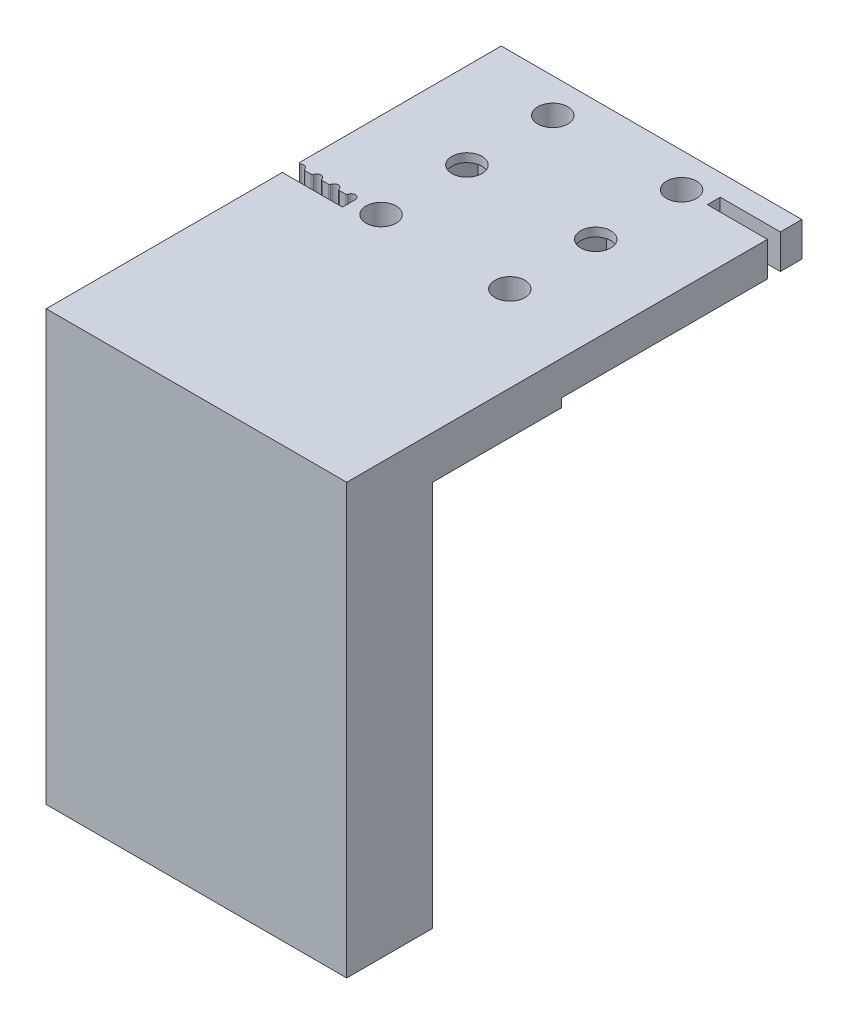
from build123d import *

# Parameters (mm, degrees)
SKETCH1_W           = 35
SKETCH1_H           = 28.000000000000004
BOSS_EXTRUDE1_DEPTH = 4
SKETCH2_R           = 1.7499999999999998
CUT_EXTRUDE1_DEPTH  = 23.765104875664424
BOSS_EXTRUDE2_DEPTH = 25
CUT_EXTRUDE14_DEPTH = 66.78183639881149
SKETCH19_R          = 1.75
CUT_EXTRUDE15_DEPTH = 66.78183639881149
CUT_EXTRUDE16_DEPTH = 2.999999999999999
SKETCH21_R          = 0.49999999999999917
CUT_EXTRUDE17_DEPTH = 3.999999999999999
LPATTERN2_COUNT     = 4
LPATTERN2_PITCH     = 2
FILLET2_R           = 0.15
SKETCH22_W          = 14.999999999999995
SKETCH22_H          = 45
CUT_EXTRUDE18_DEPTH = 70.72804313904126


with BuildPart() as part:
    # Sketch1 → Boss-Extrude1 (new body)
    with BuildSketch(Plane(origin=(0, 0, 0), x_dir=(1, 0, 0), z_dir=(0, 1, 0))):
        Rectangle(SKETCH1_W, SKETCH1_H)
    extrude(amount=BOSS_EXTRUDE1_DEPTH)

    # Sketch2 → Cut-Extrude1 (cut, through all)
    with BuildSketch(Plane(origin=(0, 4, 0), x_dir=(1, 0, 0), z_dir=(0, 1, 0))):
        with Locations(Location((-7.499999999999998, -10, 0), (0, 0, 270))):
            Circle(SKETCH2_R)
        with Locations(Location((-7.499999999999998, 10, 0), (0, 0, 270))):
            Circle(SKETCH2_R)
        with Locations(Location((7.500000000000002, -10.000000000000002, 0), (0, 0, 270))):
            Circle(SKETCH2_R)
        with Locations(Location((7.500000000000002, 10, 0), (0, 0, 270))):
            Circle(SKETCH2_R)
    extrude(amount=-CUT_EXTRUDE1_DEPTH, mode=Mode.SUBTRACT)

    # Sketch3 → Boss-Extrude2 (add)
    with BuildSketch(Plane.XY.offset(14)):
        Polygon((-17.499999999999996, 4), (17.500000000000004, 4), (17.50000000000001, -46), (-17.499999999999993, -46), align=None)
    extrude(amount=BOSS_EXTRUDE2_DEPTH)

    # Sketch18 → Cut-Extrude14 (cut, through all)
    with BuildSketch(Plane(origin=(0, 4, 0), x_dir=(1, 0, 0), z_dir=(0, 1, 0))):
        Polygon((-17.499999999999996, -9.999999999999998), (-10.499999999999998, -10.000000000000002), (-10.499999999999998, -11.500000000000002), (-17.499999999999996, -11.500000000000004), align=None)
        Polygon((17.500000000000004, 10.000000000000002), (10.500000000000002, 10), (10.500000000000002, 11.5), (17.500000000000004, 11.500000000000004), align=None)
    extrude(amount=-CUT_EXTRUDE14_DEPTH, mode=Mode.SUBTRACT)

    # Sketch19 → Cut-Extrude15 (cut, through all)
    with BuildSketch(Plane(origin=(0, 4, 0), x_dir=(1, 0, 0), z_dir=(0, 1, 0))):
        with Locations(Location((-7.499999999999998, 0, 0), (0, 0, 270))):
            Circle(SKETCH19_R)
        with Locations(Location((7.500000000000005, 0, 0), (0, 0, 270))):
            Circle(SKETCH19_R)
    extrude(amount=-CUT_EXTRUDE15_DEPTH, mode=Mode.SUBTRACT)

    # Sketch20 → Cut-Extrude16 (cut)
    with BuildSketch(Plane.XZ):
        Polygon((10.96410161513776, 9.3e-16), (9.23205080756888, 2.9999999999999996), (5.767949192431128, 2.9999999999999987), (4.035898384862253, -1.5e-16), (5.767949192431131, -3), (9.232050807568884, -2.9999999999999996), align=None)
        Polygon((-10.964101615137752, 5.88e-15), (-9.232050807568879, -2.999999999999999), (-5.767949192431124, -3.000000000000003), (-4.035898384862242, -3.87e-15), (-5.7679491924311215, 3.000000000000001), (-9.232050807568873, 3.0000000000000053), align=None)
    extrude(amount=-CUT_EXTRUDE16_DEPTH, mode=Mode.SUBTRACT)

    # Sketch21 → Cut-Extrude17 (cut)
    with BuildSketch(Plane(origin=(0, 4, 0), x_dir=(1, 0, 0), z_dir=(0, 1, 0))):
        with Locations((-16.999999999999996, -10.000000000000002)):
            Circle(SKETCH21_R)
    cut_extrude17 = extrude(amount=-CUT_EXTRUDE17_DEPTH, mode=Mode.SUBTRACT)

    # LPattern2: Cut-Extrude17 ×4
    with Locations(*[(i * LPATTERN2_PITCH, 0, 0) for i in range(1, LPATTERN2_COUNT)]):
        add(cut_extrude17, mode=Mode.SUBTRACT)

    # Fillet2
    fillet2_edges = [part.edges().sort_by_distance(p)[0] for p in [
        (-16.499999999999996, 2.0000000000000004, 10.000000000000002),
        (-12.499999999999996, 2.0000000000000004, 10.000000000000005),
        (-13.499999999999996, 2, 10),
        (-14.499999999999996, 2.0000000000000004, 10.000000000000004),
        (-15.499999999999996, 2, 10),
        (-11.499999999999996, 2, 10.000000000000002),
        (-17.499999999999996, 2, 9.999999999999998),
    ]]
    fillet(fillet2_edges, radius=FILLET2_R)

    # Sketch22 → Cut-Extrude18 (cut, through all)
    with BuildSketch(Plane.ZY.offset(17.499999999999996)):
        with Locations((21.5, -23.5)):
            Rectangle(SKETCH22_W, SKETCH22_H)
    extrude(amount=-CUT_EXTRUDE18_DEPTH, mode=Mode.SUBTRACT)


solid = part.part
